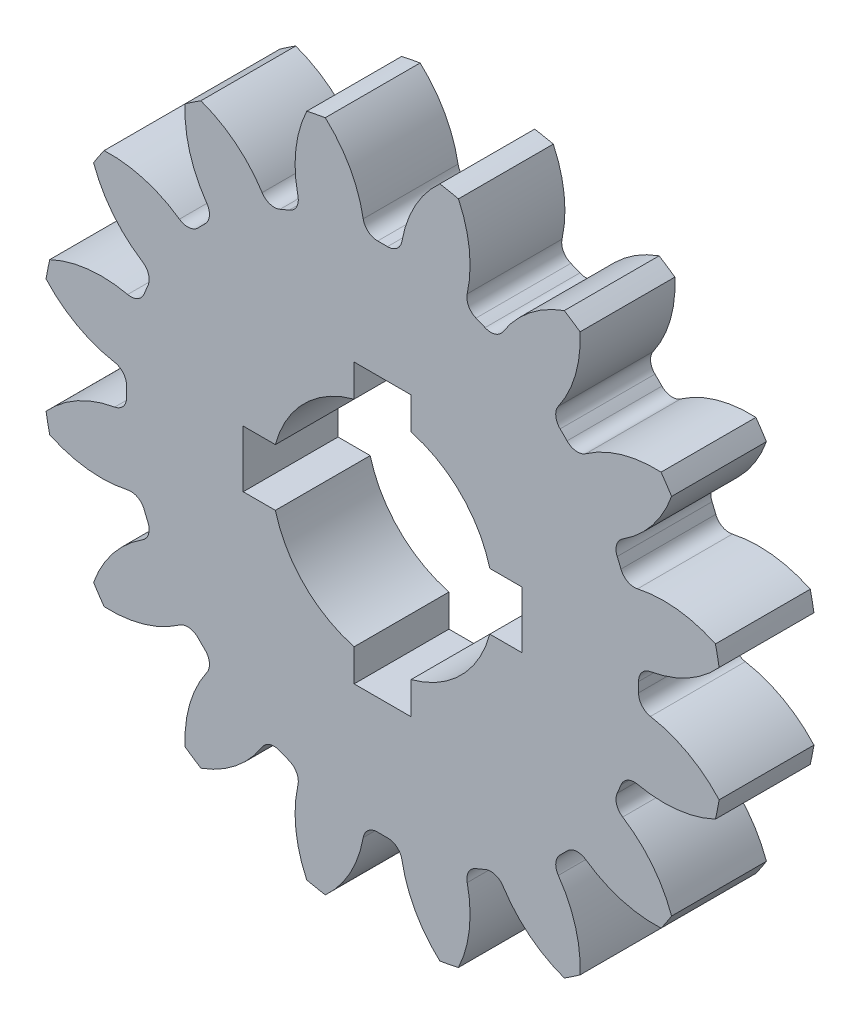
from build123d import *

# Parameters (mm, degrees)
SKETCH1_R                = 18
BOSS_EXTRUDE1_DEPTH      = 5
CUT_EXTRUDE1_DEPTH       = 10
FILLET2_R                = 0.76
CIRPATTERN2_COUNT        = 16
FILLET2_OF_CIRPATTERN2_R = 0.76
CUT_EXTRUDE2_DEPTH       = 5


with BuildPart() as part:
    # Sketch1 → Boss-Extrude1 (new body)
    with BuildSketch(Plane.XY):
        Circle(SKETCH1_R)
    extrude(amount=-BOSS_EXTRUDE1_DEPTH)

    # Sketch1<4> → Cut-Extrude1 (cut)
    with BuildSketch(Plane.XY):
        with BuildLine():
            ThreePointArc((-0.94057935, 13.467193861), (0, 13.5), (0.94057935, 13.467193861))
            ThreePointArc((0.94057935, 13.467193861), (1.565882277, 15.80744957), (3.019925663, 17.744859791))
            ThreePointArc((3.019925663, 17.744859791), (0, 18), (-3.019925663, 17.744859791))
            ThreePointArc((-3.019925663, 17.744859791), (-1.565882277, 15.80744957), (-0.94057935, 13.467193861))
        make_face()
    cut_extrude1 = extrude(amount=-CUT_EXTRUDE1_DEPTH, mode=Mode.SUBTRACT)

    # Fillet2
    fillet2_edges = [part.edges().sort_by_distance(p)[0] for p in [
        (0.94057935, 13.467193861, -2.5),
        (-0.94057935, 13.467193861, -2.5),
    ]]
    fillet(fillet2_edges, radius=FILLET2_R)

    # CirPattern2: Cut-Extrude1 ×16 about axis
    cirpattern2_axis = Axis((0, 0, 0), (0, 0, 1))
    for i in range(1, CIRPATTERN2_COUNT):
        add(cut_extrude1.rotate(cirpattern2_axis, i * 360 / CIRPATTERN2_COUNT), mode=Mode.SUBTRACT)

    # Fillet2 of CirPattern2
    fillet2_of_cirpattern2_edges = [part.edges().sort_by_distance(p)[0] for p in [
        (-4.284689961, 12.802008902, -2.5),
        (-6.022653981, 12.082120634, -2.5),
        (-8.857654066, 10.187834139, -2.5),
        (-10.187834139, 8.857654066, -2.5),
        (-12.082120634, 6.022653981, -2.5),
        (-12.802008902, 4.284689961, -2.5),
        (-13.467193861, 0.94057935, -2.5),
        (-13.467193861, -0.94057935, -2.5),
        (-12.802008902, -4.284689961, -2.5),
        (-12.082120634, -6.022653981, -2.5),
        (-10.187834139, -8.857654066, -2.5),
        (-8.857654066, -10.187834139, -2.5),
        (-6.022653981, -12.082120634, -2.5),
        (-4.284689961, -12.802008902, -2.5),
        (-0.94057935, -13.467193861, -2.5),
        (0.94057935, -13.467193861, -2.5),
        (4.284689961, -12.802008902, -2.5),
        (6.022653981, -12.082120634, -2.5),
        (8.857654066, -10.187834139, -2.5),
        (10.187834139, -8.857654066, -2.5),
        (12.082120634, -6.022653981, -2.5),
        (12.802008902, -4.284689961, -2.5),
        (13.467193861, -0.94057935, -2.5),
        (13.467193861, 0.94057935, -2.5),
        (12.802008902, 4.284689961, -2.5),
        (12.082120634, 6.022653981, -2.5),
        (10.187834139, 8.857654066, -2.5),
        (8.857654066, 10.187834139, -2.5),
        (6.022653981, 12.082120634, -2.5),
        (4.284689961, 12.802008902, -2.5),
    ]]
    fillet(fillet2_of_cirpattern2_edges, radius=FILLET2_OF_CIRPATTERN2_R)

    # Sketch2 → Cut-Extrude2 (cut)
    with BuildSketch(Plane.XY):
        with BuildLine():
            Line((-1.5, 5.652839314), (-1.5, 7.348469228))
            Line((-1.5, 7.348469228), (1.5, 7.348469228))
            Line((1.5, 7.348469228), (1.5, 5.652839314))
            ThreePointArc((1.5, 5.652839314), (4.135492251, 4.135492251), (5.652839314, 1.5))
            Line((5.652839314, 1.5), (7.348469228, 1.5))
            Line((7.348469228, 1.5), (7.348469228, -1.5))
            Line((7.348469228, -1.5), (5.652839314, -1.5))
            ThreePointArc((5.652839314, -1.5), (4.135492251, -4.135492251), (1.5, -5.652839314))
            Line((1.5, -5.652839314), (1.5, -7.348469228))
            Line((1.5, -7.348469228), (-1.5, -7.348469228))
            Line((-1.5, -7.348469228), (-1.5, -5.652839314))
            ThreePointArc((-1.5, -5.652839314), (-4.135492251, -4.135492251), (-5.652839314, -1.5))
            Line((-5.652839314, -1.5), (-7.348469228, -1.5))
            Line((-7.348469228, -1.5), (-7.348469228, 1.5))
            Line((-7.348469228, 1.5), (-5.652839314, 1.5))
            ThreePointArc((-5.652839314, 1.5), (-4.135492251, 4.135492251), (-1.5, 5.652839314))
        make_face()
    extrude(amount=-CUT_EXTRUDE2_DEPTH, mode=Mode.SUBTRACT)


solid = part.part
